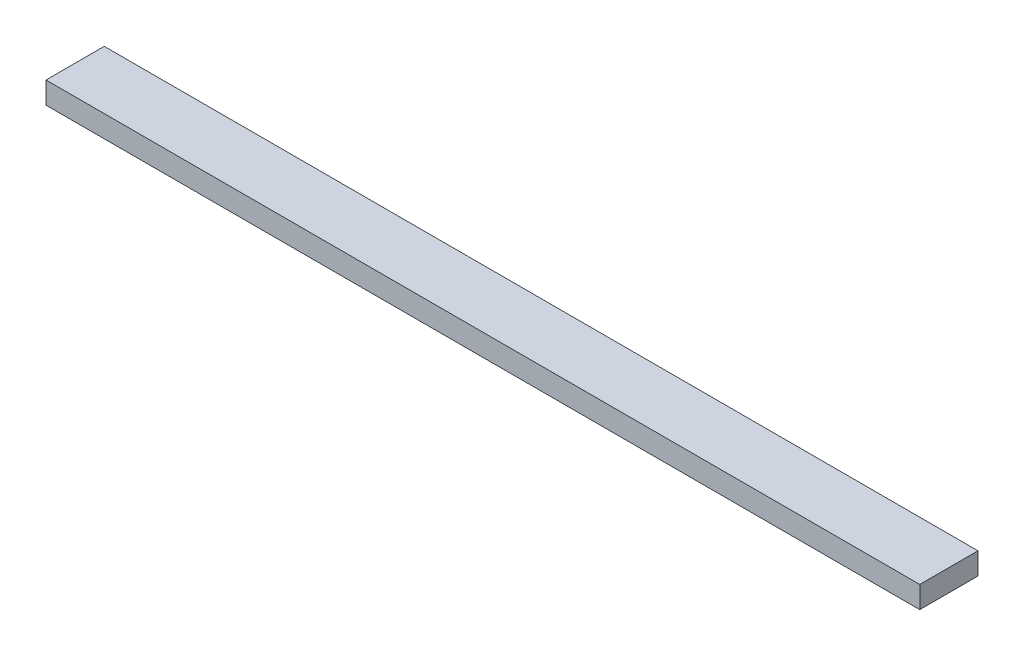
from build123d import *

# Parameters (mm, degrees)
SKETCH1_W           = 762
SKETCH1_H           = 50.8
BOSS_EXTRUDE1_DEPTH = 19.05


with BuildPart() as part:
    # Sketch1 → Boss-Extrude1 (new body)
    with BuildSketch(Plane(origin=(0, 0, 0), x_dir=(1, 0, 0), z_dir=(0, 1, 0))):
        Rectangle(SKETCH1_W, SKETCH1_H)
    extrude(amount=BOSS_EXTRUDE1_DEPTH)


solid = part.part
